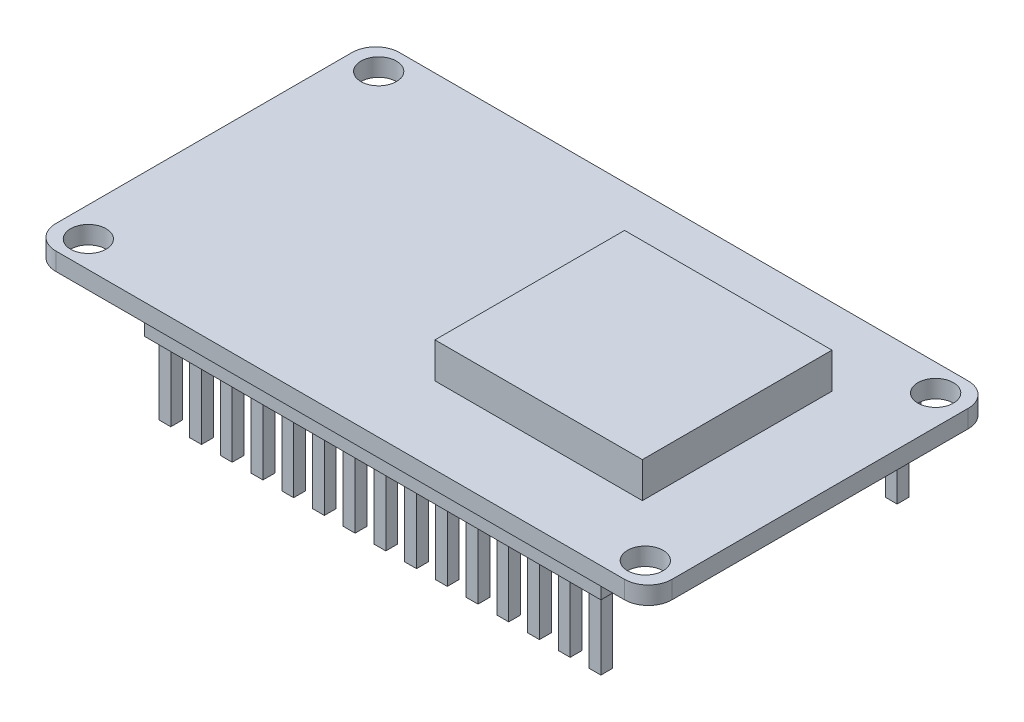
from build123d import *

# Parameters (mm, degrees)
SKETCH1_R           = 1.5
BOSS_EXTRUDE1_DEPTH = 1.5
SKETCH2_W           = 38.5
SKETCH2_H           = 2
BOSS_EXTRUDE2_DEPTH = 2
SKETCH3_W           = 17.5
SKETCH3_H           = 16
BOSS_EXTRUDE3_DEPTH = 3
SKETCH4_W           = 1
SKETCH4_H           = 1
BOSS_EXTRUDE4_DEPTH = 8


with BuildPart() as part:
    # Sketch1 → Boss-Extrude1 (new body)
    with BuildSketch(Plane(origin=(0, 0, 0), x_dir=(1, 0, 0), z_dir=(0, 1, 0))):
        with BuildLine():
            Line((24, -14.5), (-24, -14.5))
            ThreePointArc((-24, -14.5), (-25.414213562, -13.914213562), (-26, -12.5))
            Line((-26, -12.5), (-26, 12.5))
            ThreePointArc((-26, 12.5), (-25.414213562, 13.914213562), (-24, 14.5))
            Line((-24, 14.5), (24, 14.5))
            ThreePointArc((24, 14.5), (25.414213562, 13.914213562), (26, 12.5))
            Line((26, 12.5), (26, -12.5))
            ThreePointArc((26, -12.5), (25.414213562, -13.914213562), (24, -14.5))
        make_face()
        with Locations(Location((-23.5, 12.25, 0), (0, 0, 270))):
            Circle(SKETCH1_R, mode=Mode.SUBTRACT)
        with Locations(Location((23.5, 12.25, 0), (0, 0, 90))):
            Circle(SKETCH1_R, mode=Mode.SUBTRACT)
        with Locations(Location((23.5, -12.25, 0), (0, 0, 270))):
            Circle(SKETCH1_R, mode=Mode.SUBTRACT)
        with Locations(Location((-23.5, -12.25, 0), (0, 0, 90))):
            Circle(SKETCH1_R, mode=Mode.SUBTRACT)
    extrude(amount=BOSS_EXTRUDE1_DEPTH)

    # Sketch2 → Boss-Extrude2 (add)
    with BuildSketch(Plane(origin=(0, 0, 0), x_dir=(1, 0, 0), z_dir=(0, 1, 0))):
        with Locations((1.75, -12.5)):
            Rectangle(SKETCH2_W, SKETCH2_H)
        with Locations((1.75, 12.5)):
            Rectangle(SKETCH2_W, SKETCH2_H)
    extrude(amount=-BOSS_EXTRUDE2_DEPTH)

    # Sketch3 → Boss-Extrude3 (add)
    with BuildSketch(Plane(origin=(0, 1.5, 0), x_dir=(1, 0, 0), z_dir=(0, 1, 0))):
        with Locations((10.25, 0)):
            Rectangle(SKETCH3_W, SKETCH3_H)
    extrude(amount=BOSS_EXTRUDE3_DEPTH)

    # Sketch4 → Boss-Extrude4 (add)
    with BuildSketch(Plane(origin=(0, 0, 0), x_dir=(1, 0, 0), z_dir=(0, 1, 0))):
        with Locations((20, 12.5)):
            Rectangle(SKETCH4_W, SKETCH4_H)
        with Locations((17.4075, 12.5)):
            Rectangle(SKETCH4_W, SKETCH4_H)
        with Locations((14.815, 12.5)):
            Rectangle(SKETCH4_W, SKETCH4_H)
        with Locations((12.2225, 12.5)):
            Rectangle(SKETCH4_W, SKETCH4_H)
        with Locations((9.63, 12.5)):
            Rectangle(SKETCH4_W, SKETCH4_H)
        with Locations((7.0375, 12.5)):
            Rectangle(SKETCH4_W, SKETCH4_H)
        with Locations((4.445, 12.5)):
            Rectangle(SKETCH4_W, SKETCH4_H)
        with Locations((1.8525, 12.5)):
            Rectangle(SKETCH4_W, SKETCH4_H)
        with Locations((-0.74, 12.5)):
            Rectangle(SKETCH4_W, SKETCH4_H)
        with Locations((-3.3325, 12.5)):
            Rectangle(SKETCH4_W, SKETCH4_H)
        with Locations((-5.925, 12.5)):
            Rectangle(SKETCH4_W, SKETCH4_H)
        with Locations((-8.5175, 12.5)):
            Rectangle(SKETCH4_W, SKETCH4_H)
        with Locations((-11.11, 12.5)):
            Rectangle(SKETCH4_W, SKETCH4_H)
        with Locations((-13.7025, 12.5)):
            Rectangle(SKETCH4_W, SKETCH4_H)
        with Locations((-16.295, 12.5)):
            Rectangle(SKETCH4_W, SKETCH4_H)
        with Locations((-16.295, -12.5)):
            Rectangle(SKETCH4_W, SKETCH4_H)
        with Locations((-13.7025, -12.5)):
            Rectangle(SKETCH4_W, SKETCH4_H)
        with Locations((-11.11, -12.5)):
            Rectangle(SKETCH4_W, SKETCH4_H)
        with Locations((-8.5175, -12.5)):
            Rectangle(SKETCH4_W, SKETCH4_H)
        with Locations((-5.925, -12.5)):
            Rectangle(SKETCH4_W, SKETCH4_H)
        with Locations((-3.3325, -12.5)):
            Rectangle(SKETCH4_W, SKETCH4_H)
        with Locations((-0.74, -12.5)):
            Rectangle(SKETCH4_W, SKETCH4_H)
        with Locations((1.8525, -12.5)):
            Rectangle(SKETCH4_W, SKETCH4_H)
        with Locations((4.445, -12.5)):
            Rectangle(SKETCH4_W, SKETCH4_H)
        with Locations((7.0375, -12.5)):
            Rectangle(SKETCH4_W, SKETCH4_H)
        with Locations((9.63, -12.5)):
            Rectangle(SKETCH4_W, SKETCH4_H)
        with Locations((12.2225, -12.5)):
            Rectangle(SKETCH4_W, SKETCH4_H)
        with Locations((14.815, -12.5)):
            Rectangle(SKETCH4_W, SKETCH4_H)
        with Locations((17.4075, -12.5)):
            Rectangle(SKETCH4_W, SKETCH4_H)
        with Locations((20, -12.5)):
            Rectangle(SKETCH4_W, SKETCH4_H)
    extrude(amount=-BOSS_EXTRUDE4_DEPTH)


solid = part.part
